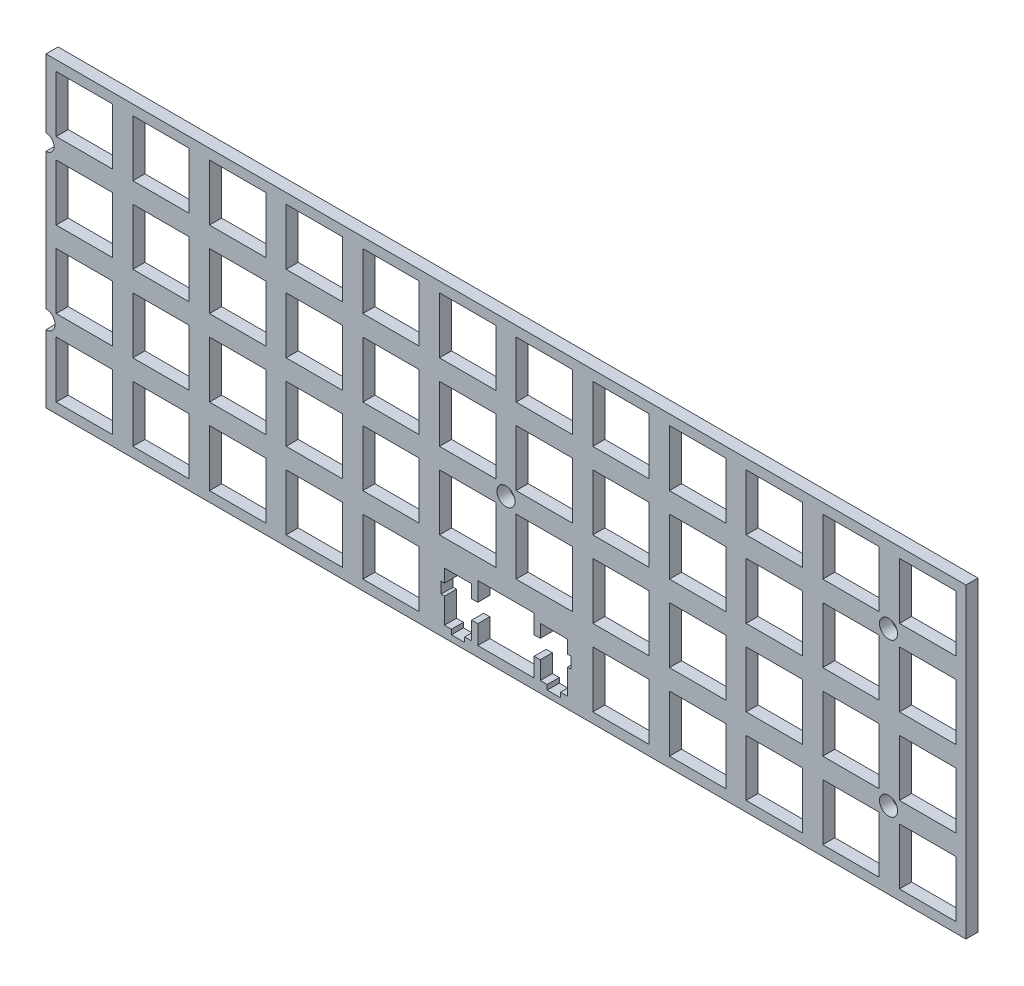
from build123d import *

# Parameters (mm, degrees)
MODEL_W             = 228.5999154
MODEL_H             = 76.199807
MODEL_W_2           = 13.99955
MODEL_H_2           = 13.99946
MODEL_W_3           = 13.9993
MODEL_W_4           = 13.999
MODEL_H_3           = 13.9994
MODEL_W_5           = 14.0007
MODEL_W_6           = 14.001
MODEL_H_4           = 13.9993
BOSS_EXTRUDE1_DEPTH = 3
SKETCH1_R           = 2.25
CUT_EXTRUDE1_DEPTH  = 242.155867296


with BuildPart() as part:
    # Model → Boss-Extrude1 (new body)
    with BuildSketch(Plane.XY):
        with Locations((114.3950423, 38.3575965)):
            Rectangle(MODEL_W, MODEL_H)
        Polygon((107.395, 16.7831), (107.395, 12.0826), (105.869, 12.0826), (105.869, 15.3128), (99.1182, 15.3128), (99.1182, 12.0826), (98.2941, 12.0826), (98.2941, 9.28384), (99.1182, 9.28384), (99.1182, 3.01377), (100.845, 3.01377), (100.845, 1.8135), (104.144, 1.8135), (104.144, 3.01377), (105.869, 3.01377), (105.869, 7.48273), (107.395, 7.48273), (107.395, 2.78364), (121.394, 2.78364), (121.394, 7.48273), (122.92, 7.48273), (122.92, 3.01377), (124.645, 3.01377), (124.645, 1.8135), (127.944, 1.8135), (127.944, 3.01377), (129.669, 3.01377), (129.669, 9.28384), (130.495, 9.28384), (130.495, 12.0826), (129.669, 12.0826), (129.669, 15.3128), (122.92, 15.3128), (122.92, 12.0826), (121.394, 12.0826), (121.394, 16.7831), align=None, mode=Mode.SUBTRACT)
        with Locations((9.619425, 9.78337)):
            Rectangle(MODEL_W_2, MODEL_H_2, mode=Mode.SUBTRACT)
        with Locations((28.66935, 9.78337)):
            Rectangle(MODEL_W_3, MODEL_H_2, mode=Mode.SUBTRACT)
        with Locations((47.71935, 9.78337)):
            Rectangle(MODEL_W_3, MODEL_H_2, mode=Mode.SUBTRACT)
        with Locations((66.76935, 9.78337)):
            Rectangle(MODEL_W_3, MODEL_H_2, mode=Mode.SUBTRACT)
        with Locations((85.81935, 9.78337)):
            Rectangle(MODEL_W_3, MODEL_H_2, mode=Mode.SUBTRACT)
        with Locations((142.9695, 9.78337)):
            Rectangle(MODEL_W_4, MODEL_H_2, mode=Mode.SUBTRACT)
        with Locations((162.0195, 9.78337)):
            Rectangle(MODEL_W_4, MODEL_H_2, mode=Mode.SUBTRACT)
        with Locations((181.0695, 9.78337)):
            Rectangle(MODEL_W_4, MODEL_H_2, mode=Mode.SUBTRACT)
        with Locations((200.1195, 9.78337)):
            Rectangle(MODEL_W_4, MODEL_H_2, mode=Mode.SUBTRACT)
        with Locations((219.1695, 9.78337)):
            Rectangle(MODEL_W_4, MODEL_H_2, mode=Mode.SUBTRACT)
        with Locations((9.619425, 28.8333)):
            Rectangle(MODEL_W_2, MODEL_H_3, mode=Mode.SUBTRACT)
        with Locations((28.66935, 28.8333)):
            Rectangle(MODEL_W_3, MODEL_H_3, mode=Mode.SUBTRACT)
        with Locations((47.71935, 28.8333)):
            Rectangle(MODEL_W_3, MODEL_H_3, mode=Mode.SUBTRACT)
        with Locations((66.76935, 28.8333)):
            Rectangle(MODEL_W_3, MODEL_H_3, mode=Mode.SUBTRACT)
        with Locations((85.81935, 28.8333)):
            Rectangle(MODEL_W_3, MODEL_H_3, mode=Mode.SUBTRACT)
        with Locations((104.86865, 28.8333)):
            Rectangle(MODEL_W_5, MODEL_H_3, mode=Mode.SUBTRACT)
        with Locations((123.9185, 28.8333)):
            Rectangle(MODEL_W_6, MODEL_H_3, mode=Mode.SUBTRACT)
        with Locations((142.9695, 28.8333)):
            Rectangle(MODEL_W_4, MODEL_H_3, mode=Mode.SUBTRACT)
        with Locations((162.0195, 28.8333)):
            Rectangle(MODEL_W_4, MODEL_H_3, mode=Mode.SUBTRACT)
        with Locations((181.0695, 28.8333)):
            Rectangle(MODEL_W_4, MODEL_H_3, mode=Mode.SUBTRACT)
        with Locations((200.1195, 28.8333)):
            Rectangle(MODEL_W_4, MODEL_H_3, mode=Mode.SUBTRACT)
        with Locations((219.1695, 28.8333)):
            Rectangle(MODEL_W_4, MODEL_H_3, mode=Mode.SUBTRACT)
        with Locations((9.619425, 47.88345)):
            Rectangle(MODEL_W_2, MODEL_H_4, mode=Mode.SUBTRACT)
        with Locations((28.66935, 47.88345)):
            Rectangle(MODEL_W_3, MODEL_H_4, mode=Mode.SUBTRACT)
        with Locations((47.71935, 47.88345)):
            Rectangle(MODEL_W_3, MODEL_H_4, mode=Mode.SUBTRACT)
        with Locations((66.76935, 47.88345)):
            Rectangle(MODEL_W_3, MODEL_H_4, mode=Mode.SUBTRACT)
        with Locations((85.81935, 47.88345)):
            Rectangle(MODEL_W_3, MODEL_H_4, mode=Mode.SUBTRACT)
        with Locations((104.86865, 47.88345)):
            Rectangle(MODEL_W_5, MODEL_H_4, mode=Mode.SUBTRACT)
        with Locations((123.9185, 47.88345)):
            Rectangle(MODEL_W_6, MODEL_H_4, mode=Mode.SUBTRACT)
        with Locations((142.9695, 47.88345)):
            Rectangle(MODEL_W_4, MODEL_H_4, mode=Mode.SUBTRACT)
        with Locations((162.0195, 47.88345)):
            Rectangle(MODEL_W_4, MODEL_H_4, mode=Mode.SUBTRACT)
        with Locations((181.0695, 47.88345)):
            Rectangle(MODEL_W_4, MODEL_H_4, mode=Mode.SUBTRACT)
        with Locations((200.1195, 47.88345)):
            Rectangle(MODEL_W_4, MODEL_H_4, mode=Mode.SUBTRACT)
        with Locations((219.1695, 47.88345)):
            Rectangle(MODEL_W_4, MODEL_H_4, mode=Mode.SUBTRACT)
        with Locations((9.619425, 66.93345)):
            Rectangle(MODEL_W_2, MODEL_H_4, mode=Mode.SUBTRACT)
        with Locations((28.66935, 66.93345)):
            Rectangle(MODEL_W_3, MODEL_H_4, mode=Mode.SUBTRACT)
        with Locations((47.71935, 66.93345)):
            Rectangle(MODEL_W_3, MODEL_H_4, mode=Mode.SUBTRACT)
        with Locations((66.76935, 66.93345)):
            Rectangle(MODEL_W_3, MODEL_H_4, mode=Mode.SUBTRACT)
        with Locations((85.81935, 66.93345)):
            Rectangle(MODEL_W_3, MODEL_H_4, mode=Mode.SUBTRACT)
        with Locations((104.86865, 66.93345)):
            Rectangle(MODEL_W_5, MODEL_H_4, mode=Mode.SUBTRACT)
        with Locations((123.9185, 66.93345)):
            Rectangle(MODEL_W_6, MODEL_H_4, mode=Mode.SUBTRACT)
        with Locations((142.9695, 66.93345)):
            Rectangle(MODEL_W_4, MODEL_H_4, mode=Mode.SUBTRACT)
        with Locations((162.0195, 66.93345)):
            Rectangle(MODEL_W_4, MODEL_H_4, mode=Mode.SUBTRACT)
        with Locations((181.0695, 66.93345)):
            Rectangle(MODEL_W_4, MODEL_H_4, mode=Mode.SUBTRACT)
        with Locations((200.1195, 66.93345)):
            Rectangle(MODEL_W_4, MODEL_H_4, mode=Mode.SUBTRACT)
        with Locations((219.1695, 66.93345)):
            Rectangle(MODEL_W_4, MODEL_H_4, mode=Mode.SUBTRACT)
    extrude(amount=BOSS_EXTRUDE1_DEPTH)

    # Sketch1 → Cut-Extrude1 (cut, through all)
    with BuildSketch(Plane.XY.offset(3)):
        with Locations((114.394, 38.40029)):
            Circle(SKETCH1_R)
        with Locations((209.464, 19.35029)):
            Circle(SKETCH1_R)
        with Locations((209.464, 57.45029)):
            Circle(SKETCH1_R)
        with Locations((0.094, 19.35029)):
            Circle(SKETCH1_R)
        with BuildLine():
            Line((0.094, 59.45029), (0.094432, 55.500286))
            ThreePointArc((0.094432, 55.500286), (2.086578, 57.475505899), (0.094, 59.45029))
        make_face()
    extrude(amount=-CUT_EXTRUDE1_DEPTH, mode=Mode.SUBTRACT)


solid = part.part
